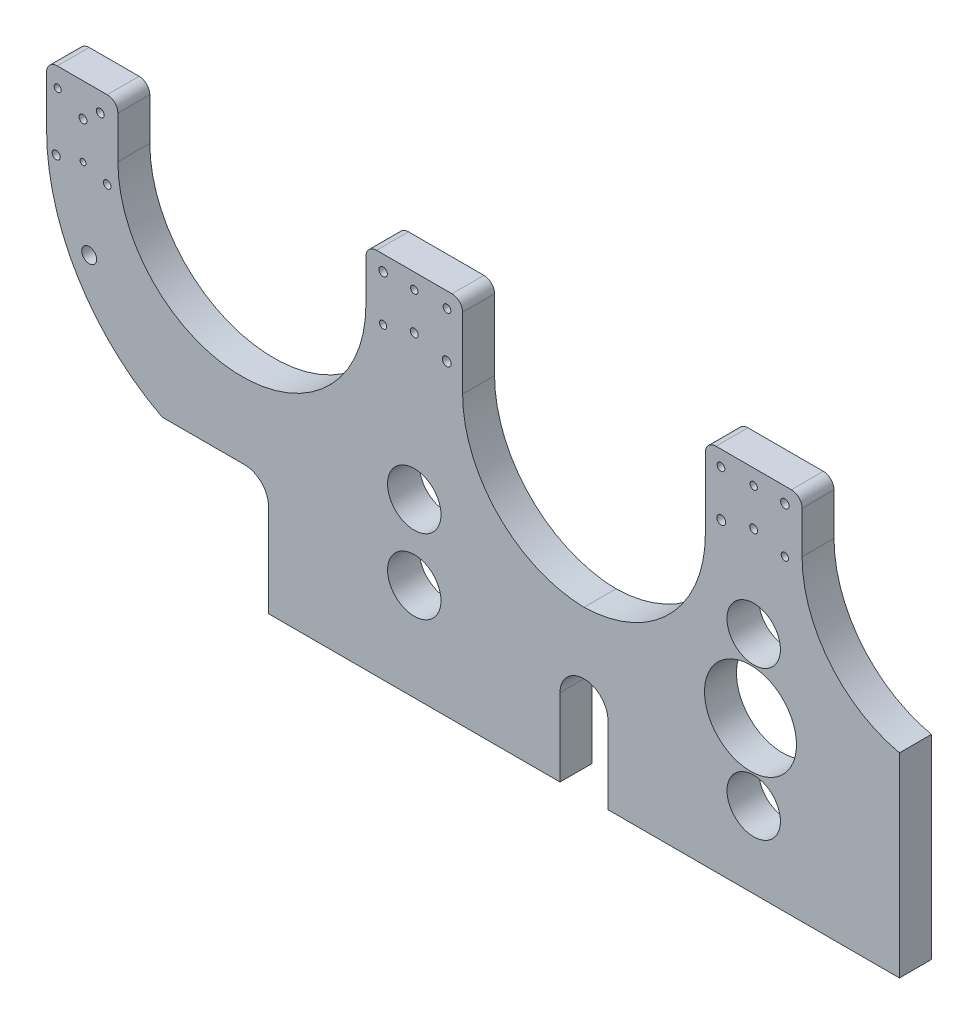
from build123d import *

# Parameters (mm, degrees)
SKETCH1_R           = 25.1
SKETCH1_R_2         = 43.202132663
SKETCH1_R_3         = 7
SKETCH1_R_4         = 3.800397256
SKETCH1_R_5         = 2.770442617
SKETCH1_R_6         = 3.592040897
SKETCH1_R_7         = 3.686204525
SKETCH1_R_8         = 3.29684687
SKETCH1_R_9         = 3.69392349
SKETCH1_R_10        = 3.414332156
SKETCH1_R_11        = 3.736354481
SKETCH1_R_12        = 4.159658534
SKETCH1_R_13        = 3.983387515
SKETCH1_R_14        = 3.611599691
BOSS_EXTRUDE1_DEPTH = 30


with BuildPart() as part:
    # Sketch1 → Boss-Extrude1 (new body)
    with BuildSketch(Plane.XY):
        with BuildLine():
            Line((22.5, 72.746158915), (22.5, 0))
            Line((22.5, 0), (296.37, 0))
            Line((296.37, 0), (296.37, 183.19))
            ThreePointArc((296.37, 183.19), (230.582473324, 223.969990415), (204.87, 296.97598332))
            Line((204.87, 296.97598332), (204.87, 336.464053823))
            ThreePointArc((204.87, 336.464053823), (201.941067812, 343.535121635), (194.87, 346.464053823))
            Line((194.87, 346.464053823), (124, 346.464053823))
            ThreePointArc((124, 346.464053823), (116.928932188, 343.535121635), (114, 336.464053823))
            Line((114, 336.464053823), (114, 269.897959103))
            ThreePointArc((114, 269.897959103), (80.757131827, 188.408696007), (0, 153.424786226))
            ThreePointArc((0, 153.424786226), (-80.757131827, 188.408696007), (-114, 269.897959103))
            Line((-114, 269.897959103), (-114, 336.464053823))
            ThreePointArc((-114, 336.464053823), (-116.928932188, 343.535121635), (-124, 346.464053823))
            Line((-124, 346.464053823), (-194.87, 346.464053823))
            ThreePointArc((-194.87, 346.464053823), (-201.941067812, 343.535121635), (-204.87, 336.464053823))
            Line((-204.87, 336.464053823), (-204.87, 296.97598332))
            ThreePointArc((-204.87, 296.97598332), (-321.37, 180.47598332), (-437.87, 296.97598332))
            Line((-437.87, 296.97598332), (-437.87, 336.464053823))
            ThreePointArc((-437.87, 336.464053823), (-440.798932188, 343.535121635), (-447.87, 346.464053823))
            Line((-447.87, 346.464053823), (-494.813243917, 346.464053823))
            ThreePointArc((-494.813243917, 346.464053823), (-501.884311728, 343.535121635), (-504.813243917, 336.464053823))
            Line((-504.813243917, 336.464053823), (-504.813243917, 288.967719833))
            ThreePointArc((-504.813243917, 288.967719833), (-475.587111443, 184.338156739), (-396.37, 110))
            Line((-396.37, 110), (-318.87, 110))
            ThreePointArc((-318.87, 110), (-302.960097423, 103.409902577), (-296.37, 87.5))
            Line((-296.37, 87.5), (-296.37, 0))
            Line((-296.37, 0), (-22.5, 0))
            Line((-22.5, 0), (-22.5, 72.740041961))
            ThreePointArc((-22.5, 72.740041961), (-15.910273536, 88.652107355), (0, 95.246158915))
            ThreePointArc((0, 95.246158915), (15.909902577, 88.656061492), (22.5, 72.746158915))
        make_face()
        with Locations((-159.43, 91.5)):
            Circle(SKETCH1_R, mode=Mode.SUBTRACT)
        with Locations((-159.44, 161.5)):
            Circle(SKETCH1_R, mode=Mode.SUBTRACT)
        with Locations((159.44, 71.5)):
            Circle(SKETCH1_R, mode=Mode.SUBTRACT)
        with Locations((156.422663426, 141.434938908)):
            Circle(SKETCH1_R_2, mode=Mode.SUBTRACT)
        with Locations((-464.813243917, 207.5)):
            Circle(SKETCH1_R_3, mode=Mode.SUBTRACT)
        with Locations((-495.795209239, 273.49)):
            Circle(SKETCH1_R_4, mode=Mode.SUBTRACT)
        with Locations((-470.58146842, 280.390080126)):
            Circle(SKETCH1_R_5, mode=Mode.SUBTRACT)
        with Locations((-447.87, 273.49)):
            Circle(SKETCH1_R_6, mode=Mode.SUBTRACT)
        with Locations((-470.58146842, 315.390080126)):
            Circle(SKETCH1_R_7, mode=Mode.SUBTRACT)
        with Locations((-494.434659893, 328.473169293)):
            Circle(SKETCH1_R_8, mode=Mode.SUBTRACT)
        with Locations((-454.434659893, 328.473169293)):
            Circle(SKETCH1_R_9, mode=Mode.SUBTRACT)
        with Locations((-188.708856361, 288.967719833)):
            Circle(SKETCH1_R_10, mode=Mode.SUBTRACT)
        with Locations((-159.44, 296.97598332)):
            Circle(SKETCH1_R_11, mode=Mode.SUBTRACT)
        with Locations((-128.95804363, 288.967719833)):
            Circle(SKETCH1_R_12, mode=Mode.SUBTRACT)
        with Locations((-188.708856361, 332.039656125)):
            Circle(SKETCH1_R_13, mode=Mode.SUBTRACT)
        with Locations((-159.44, 331.97598332)):
            Circle(SKETCH1_R_10, mode=Mode.SUBTRACT)
        with Locations((-128.708856361, 332.039656125)):
            Circle(SKETCH1_R_14, mode=Mode.SUBTRACT)
        with Locations((159.434406699, 211.370118913)):
            Circle(SKETCH1_R, mode=Mode.SUBTRACT)
        with Locations((128.95804363, 288.967719833)):
            Circle(SKETCH1_R_12, mode=Mode.SUBTRACT)
        with Locations((188.708856361, 288.967719833)):
            Circle(SKETCH1_R_10, mode=Mode.SUBTRACT)
        with Locations((159.44, 296.97598332)):
            Circle(SKETCH1_R_11, mode=Mode.SUBTRACT)
        with Locations((128.708856361, 332.039656125)):
            Circle(SKETCH1_R_14, mode=Mode.SUBTRACT)
        with Locations((159.44, 331.97598332)):
            Circle(SKETCH1_R_10, mode=Mode.SUBTRACT)
        with Locations((188.708856361, 332.039656125)):
            Circle(SKETCH1_R_13, mode=Mode.SUBTRACT)
    extrude(amount=BOSS_EXTRUDE1_DEPTH)


solid = part.part
